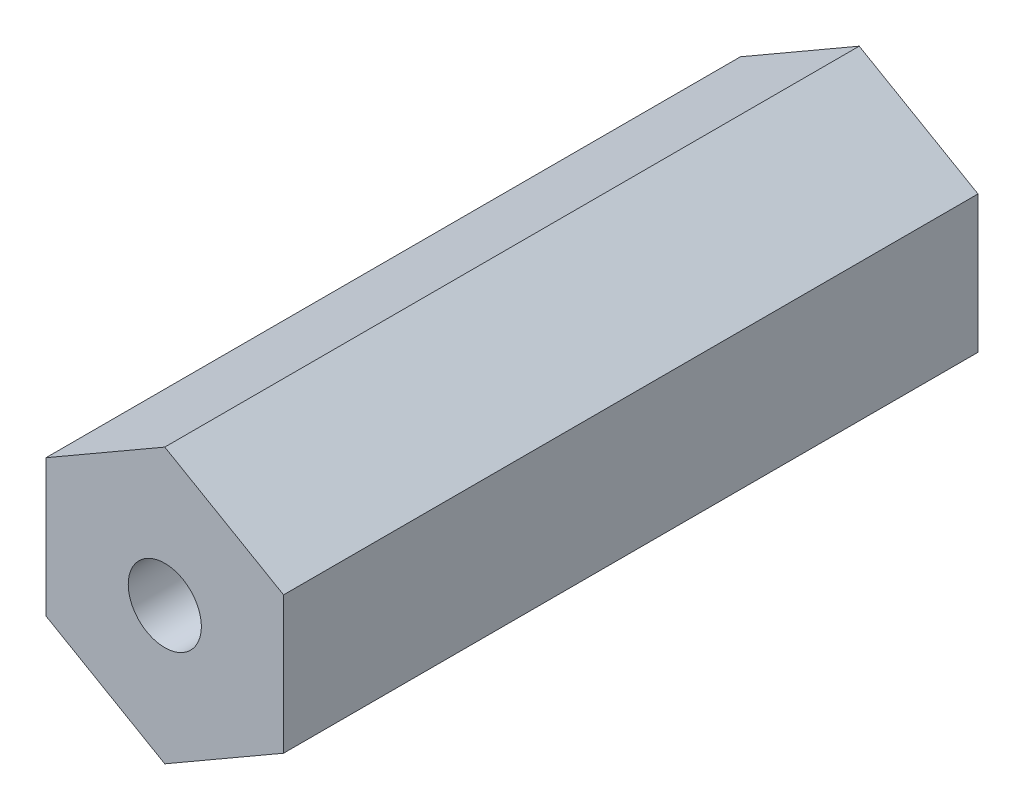
from build123d import *

# Parameters (mm, degrees)
SKETCH1_R           = 3.175
BOSS_EXTRUDE1_DEPTH = 60.325


with BuildPart() as part:
    # Sketch1 → Boss-Extrude1 (new body)
    with BuildSketch(Plane.XY):
        Polygon((10.31875, -5.95753309), (10.31875, 5.95753309), (0, 11.91506618), (-10.31875, 5.95753309), (-10.31875, -5.95753309), (0, -11.91506618), align=None)
        with Locations(Location((0, 0, 0), (0, 0, 180))):
            Circle(SKETCH1_R, mode=Mode.SUBTRACT)
    extrude(amount=BOSS_EXTRUDE1_DEPTH)


solid = part.part
